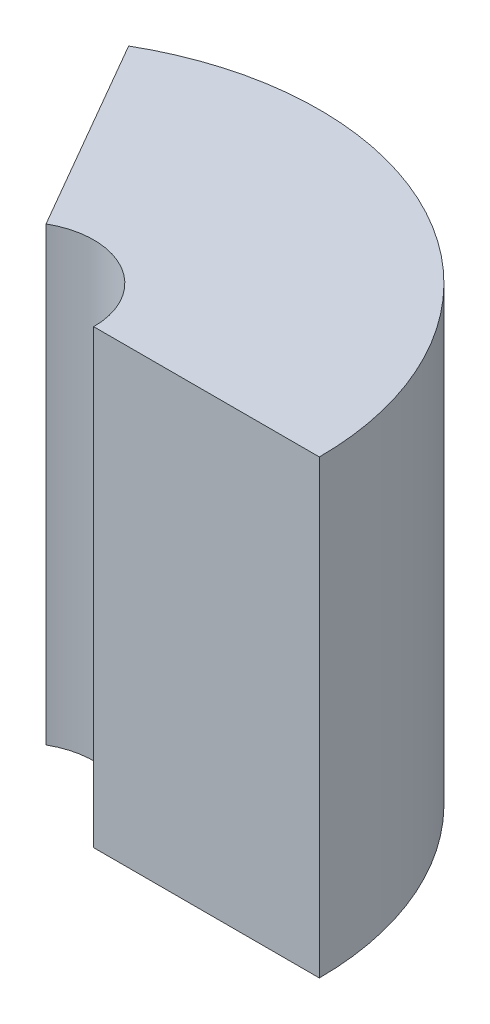
from build123d import *

# Parameters (mm, degrees)
SKETCH1_W      = 15
SKETCH1_H      = 30
REVOLVE1_ANGLE = 120


with BuildPart() as part:
    # Sketch1 → Revolve1 (revolve)
    with BuildSketch(Plane.XY):
        with Locations((12.5, 15)):
            Rectangle(SKETCH1_W, SKETCH1_H)
    revolve(axis=Axis((0, 0, 0), (0, 1, 0)), revolution_arc=REVOLVE1_ANGLE)


solid = part.part
